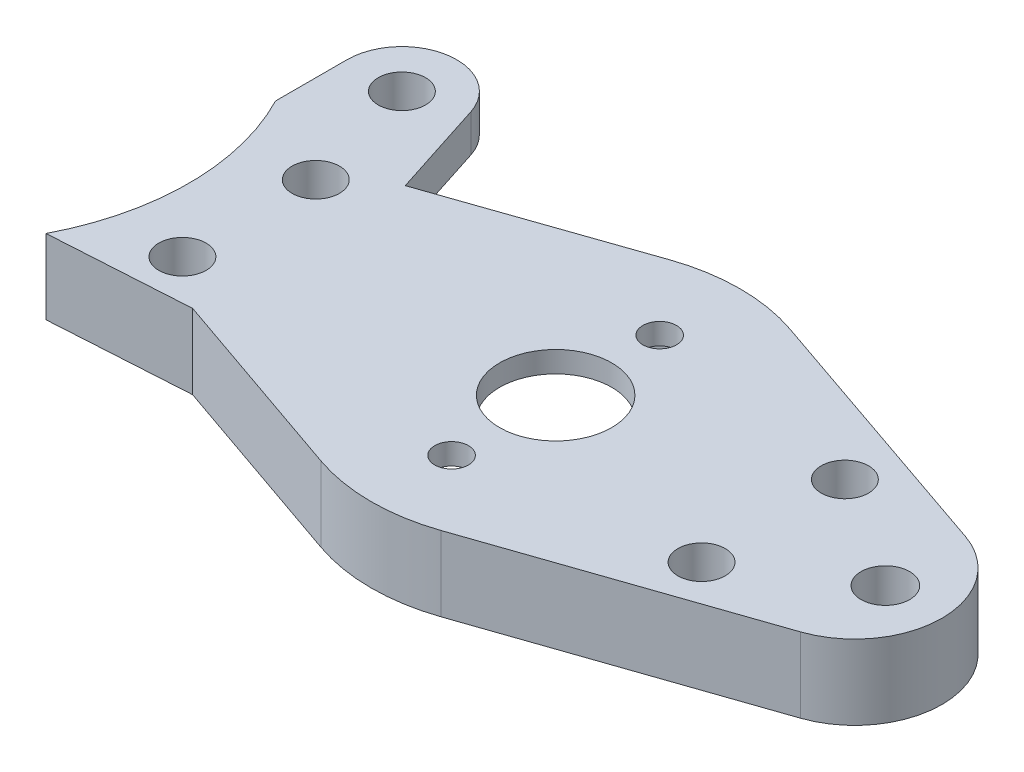
from build123d import *

# Parameters (mm, degrees)
SKETCH1_R           = 1.9
SKETCH1_R_2         = 1.95
BOSS_EXTRUDE1_DEPTH = 6
SKETCH2_R           = 12.3
CUT_EXTRUDE1_DEPTH  = 4.3
SKETCH5_R           = 1.35
SKETCH5_R_2         = 4.5
CUT_EXTRUDE3_DEPTH  = 6
SKETCH6_R           = 1.9
BOSS_EXTRUDE3_DEPTH = 3


with BuildPart() as part:
    # Sketch1 → Boss-Extrude1 (new body)
    with BuildSketch(Plane(origin=(0, 0, 0), x_dir=(1, 0, 0), z_dir=(0, 1, 0))):
        with BuildLine():
            Line((11.089751242, 8.53), (0, 9.208278243))
            ThreePointArc((0, 9.208278243), (2.245912814, 0), (0, -9.208278243))
            Line((0, -9.208278243), (11.089751242, -8.53))
            Line((11.089751242, -8.53), (26.847851363, -13.985564185))
            ThreePointArc((26.847851363, -13.985564185), (31.672879121, -14.799990383), (36.499751242, -13.996567436))
            Line((36.499751242, -13.996567436), (57.964751242, -6.619998112))
            ThreePointArc((57.964751242, -6.619998112), (62.689751242, 0), (57.964751242, 6.619998112))
            Line((57.964751242, 6.619998112), (36.499751242, 13.996567436))
            ThreePointArc((36.499751242, 13.996567436), (31.672879121, 14.799990383), (26.847851363, 13.985564185))
            Line((26.847851363, 13.985564185), (11.089751242, 8.53))
        make_face()
        with Locations(Location((7.089751242, -5.35, 0), (0, 0, 270))):
            Circle(SKETCH1_R, mode=Mode.SUBTRACT)
        with Locations(Location((7.089751242, 5.35, 0), (0, 0, 270))):
            Circle(SKETCH1_R, mode=Mode.SUBTRACT)
        with Locations(Location((49.14768086, 5.75, 0), (0, 0, 270))):
            Circle(SKETCH1_R, mode=Mode.SUBTRACT)
        with Locations(Location((49.14768086, -5.75, 0), (0, 0, 270))):
            Circle(SKETCH1_R, mode=Mode.SUBTRACT)
        with Locations(Location((58.14768086, 0, 0), (0, 0, 270))):
            Circle(SKETCH1_R_2, mode=Mode.SUBTRACT)
    extrude(amount=BOSS_EXTRUDE1_DEPTH)

    # Sketch2 → Cut-Extrude1 (cut)
    with BuildSketch(Plane(origin=(0, 0, 0), x_dir=(1, 0, 0), z_dir=(0, 1, 0))):
        with Locations(Location((31.689751242, 0, 0), (0, 0, 270))):
            Circle(SKETCH2_R)
    extrude(amount=CUT_EXTRUDE1_DEPTH, mode=Mode.SUBTRACT)

    # Sketch5 → Cut-Extrude3 (cut)
    with BuildSketch(Plane(origin=(0, 0, 0), x_dir=(1, 0, 0), z_dir=(0, 1, 0))):
        with Locations(Location((31.689751242, 8.35, 0), (0, 0, 270))):
            Circle(SKETCH5_R)
        with Locations(Location((31.689751242, -8.35, 0), (0, 0, 270))):
            Circle(SKETCH5_R)
        with Locations(Location((31.689751242, 0, 0), (0, 0, 270))):
            Circle(SKETCH5_R_2)
    extrude(amount=CUT_EXTRUDE3_DEPTH, mode=Mode.SUBTRACT)

    # Sketch6 → Boss-Extrude3 (add)
    # profile 1 of 2: a face of its own
    with BuildSketch(Plane(origin=(0, 6, 0), x_dir=(1, 0, 0), z_dir=(0, 1, 0))):
        with BuildLine():
            Line((0, 14.950374836), (0, 9.208278243))
            Line((0, 9.208278243), (11.089751242, 8.53))
            Line((11.089751242, 8.53), (8.588241962, 16.298940471))
            ThreePointArc((8.588241962, 16.298940471), (3.717454995, 19.29711296), (0, 14.950374836))
        make_face()
        with Locations(Location((4.4, 14.950374836, 0), (0, 0, 270))):
            Circle(SKETCH6_R, mode=Mode.SUBTRACT)
    # profile 2 of 2: a face of its own
    with BuildSketch(Plane(origin=(0, 6, 0), x_dir=(1, 0, 0), z_dir=(0, 1, 0))):
        with BuildLine():
            Line((0, 14.950374836), (0, 9.208278243))
            Line((0, 9.208278243), (11.089751242, 8.53))
            Line((11.089751242, 8.53), (8.588241962, 16.298940471))
            ThreePointArc((8.588241962, 16.298940471), (3.717454995, 19.29711296), (0, 14.950374836))
        make_face()
        with Locations(Location((4.4, 14.950374836, 0), (0, 0, 270))):
            Circle(SKETCH6_R, mode=Mode.SUBTRACT)
    extrude(amount=-BOSS_EXTRUDE3_DEPTH)


solid = part.part
